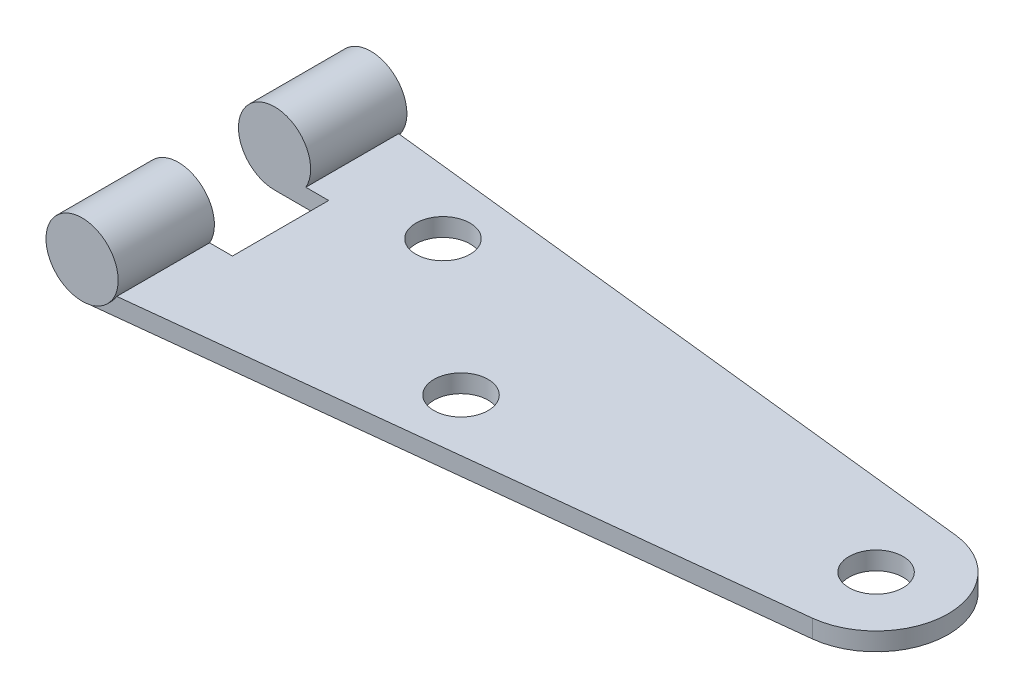
from build123d import *

# Parameters (mm, degrees)
SKETCH1_R               = 2.38125
BOSS_EXTRUDE1_DEPTH     = 1.5875
SKETCH2_W               = 25.4
SKETCH2_H               = 3.175
CUT_EXTRUDE1_DEPTH      = 62.831036149
CUT_EXTRUDE1_DEPTH_BACK = 62.831036149
SKETCH3_W               = 7.9375
SKETCH3_H               = 8.466666666


with BuildPart() as part:
    # Sketch1 → Boss-Extrude1 (new body)
    with BuildSketch(Plane(origin=(0, 0, 0), x_dir=(1, 0, 0), z_dir=(0, 1, 0))):
        with BuildLine():
            Line((-57.15, 12.7), (-57.15, -12.7))
            Line((-57.15, -12.7), (0.697028502, -6.311628258))
            ThreePointArc((0.697028502, -6.311628258), (6.35, 0), (0.697028502, 6.311628258))
            Line((0.697028502, 6.311628258), (-57.15, 12.7))
        make_face()
        with Locations(Location((0, 0, 0), (0, 0, 270))):
            Circle(SKETCH1_R, mode=Mode.SUBTRACT)
        with Locations(Location((-44.45, 6.35, 0), (0, 0, 270))):
            Circle(SKETCH1_R, mode=Mode.SUBTRACT)
        with Locations(Location((-31.75, -4.7625, 0), (0, 0, 270))):
            Circle(SKETCH1_R, mode=Mode.SUBTRACT)
    extrude(amount=BOSS_EXTRUDE1_DEPTH)

    # Sketch2 → Revolve1 (revolve)
    with BuildSketch(Plane.ZY.offset(57.15)):
        with Locations((0, 1.5875)):
            Rectangle(SKETCH2_W, SKETCH2_H)
    revolve(axis=Axis((-57.15, 3.175, -12.7), (0, 0, 1)))

    # Sketch3 → Cut-Extrude1 (cut, two sides: drawn at the far end of the back side and taken through both)
    with BuildSketch(Plane(origin=(0, 1.5875, 0), x_dir=(1, 0, 0), z_dir=(0, 1, 0)).offset(-CUT_EXTRUDE1_DEPTH_BACK)):
        with Locations((-56.35625, 0)):
            Rectangle(SKETCH3_W, SKETCH3_H)
    extrude(amount=CUT_EXTRUDE1_DEPTH + CUT_EXTRUDE1_DEPTH_BACK, mode=Mode.SUBTRACT)


solid = part.part
